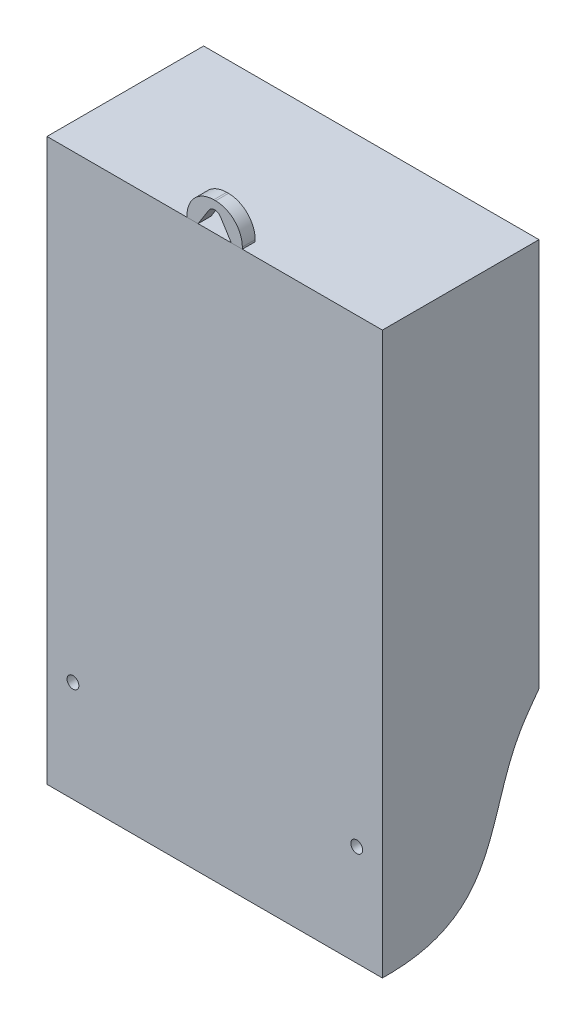
from build123d import *

# Parameters (mm, degrees)
SKETCH_1_W               = 182
SKETCH_1_H               = 304.5
EXTRUDE_1_DEPTH          = 85
EXTRUDE_2_DEPTH          = 7
CUT_EXTRUDE_1_DEPTH      = 262.704150712
CUT_EXTRUDE_1_DEPTH_BACK = 262.704150712
SKETCH_5_R               = 3.75
SKETCH_5_R_2             = 3.2
CUT_EXTRUDE_2_DEPTH      = 5
SKETCH_6_W               = 162.16521046
SKETCH_6_H               = 91.878306209
CUT_EXTRUDE_3_DEPTH      = 0.1


with BuildPart() as part:
    # Эскиз1 → Бобышка-Вытянуть1 (new body)
    with BuildSketch(Plane.XY):
        Rectangle(SKETCH_1_W, SKETCH_1_H)
    extrude(amount=EXTRUDE_1_DEPTH)

    # Эскиз4 → Вырез-Вытянуть1 (cut, two sides: drawn at the far end of the back side and taken through both)
    with BuildSketch(Plane(origin=(91, 0, 0), x_dir=(0, 0, -1), z_dir=(1, 0, 0)).offset(-CUT_EXTRUDE_1_DEPTH_BACK)):
        with BuildLine():
            add(Edge.make_bspline(
                [(-79.816818668, -152.25), (-21.71031979, -150.970361607), (-29.675754805, -98.029408424), (-3.644977075, -63.810589699), (0, -58.75)],
                knots=[0.023977741, 0.023977741, 0.023977741, 0.023977741, 0.856671902, 1, 1, 1, 1], degree=3))
            Line((-79.816818668, -152.25), (0, -152.25))
            Line((0, -152.25), (0, -58.75))
        make_face()
    extrude(amount=CUT_EXTRUDE_1_DEPTH + CUT_EXTRUDE_1_DEPTH_BACK, mode=Mode.SUBTRACT)

    # Эскиз5 → Вырез-Вытянуть2 (cut)
    with BuildSketch(Plane.XY.offset(85)):
        with Locations((0, 159.5)):
            Circle(SKETCH_5_R)
        with Locations((77.085640869, -97.5)):
            Circle(SKETCH_5_R_2)
        with Locations(Location((-76.914171143, -97.259375294, 0), (0, 0, 180))):
            Circle(SKETCH_5_R_2)
    extrude(amount=-CUT_EXTRUDE_2_DEPTH, mode=Mode.SUBTRACT)

    # Эскиз6 → Вырез-Вытянуть3 (cut)
    with BuildSketch(Plane(origin=(0, 0, 0), x_dir=(-1, 0, 0), z_dir=(0, 0, -1))):
        with Locations((0, 75.280555064)):
            Rectangle(SKETCH_6_W, SKETCH_6_H)
    extrude(amount=-CUT_EXTRUDE_3_DEPTH, mode=Mode.SUBTRACT)


with BuildPart() as body_2:
    # Эскиз3 → Бобышка-Вытянуть2 (new body)
    with BuildSketch(Plane.XY.offset(85)):
        with BuildLine():
            Line((-9, 152.25), (-3.172788215, 161.498978474))
            ThreePointArc((-3.172788215, 161.498978474), (0, 163.25), (3.172788215, 161.498978474))
            Line((3.172788215, 161.498978474), (9, 152.25))
            Line((9, 152.25), (15, 152.25))
            Line((15, 152.25), (15, 153.25))
            ThreePointArc((15, 153.25), (10.753048327, 163.503048327), (0.5, 167.75))
            Line((0.5, 167.75), (-0.5, 167.75))
            ThreePointArc((-0.5, 167.75), (-10.753048327, 163.503048327), (-15, 153.25))
            Line((-15, 153.25), (-15, 152.25))
            Line((-15, 152.25), (-9, 152.25))
        make_face()
    extrude(amount=-EXTRUDE_2_DEPTH)


solid = Compound([part.part, body_2.part])
